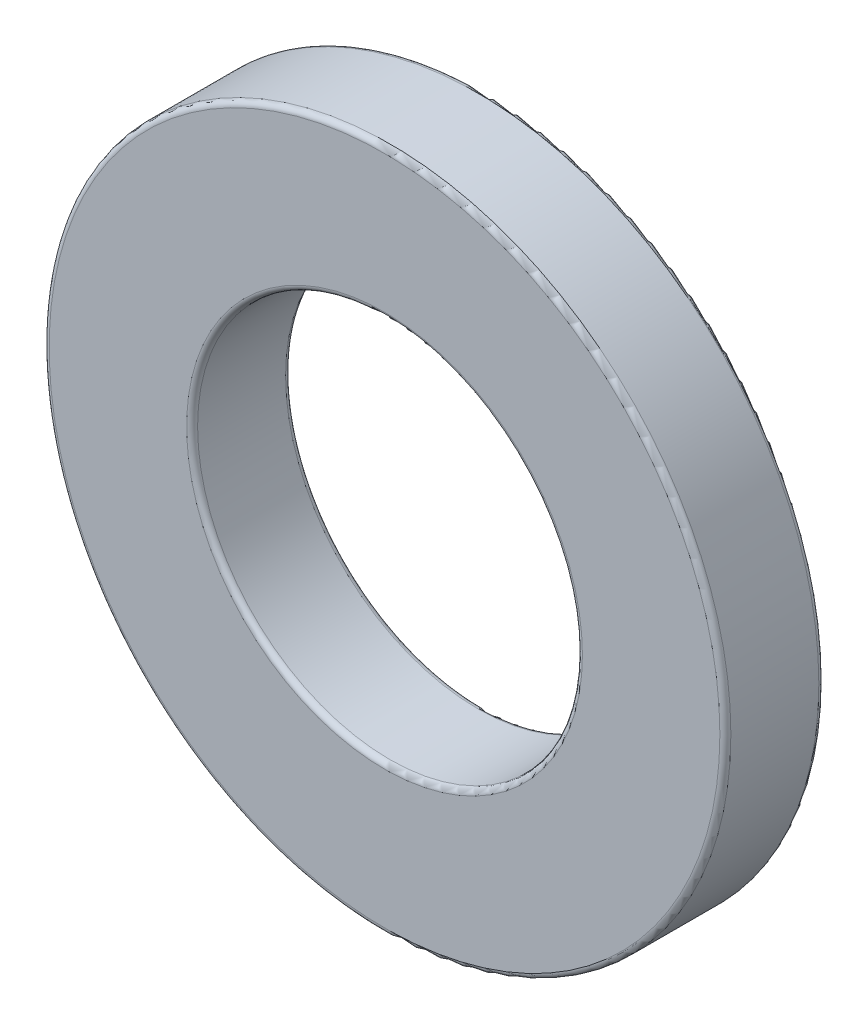
from build123d import *

# Parameters (mm, degrees)
SKETCH_1_R      = 31
SKETCH_1_R_2    = 17.5
EXTRUDE_1_DEPTH = 9
FILLET_1_R      = 0.5


with BuildPart() as part:
    # 草图1 → 拉伸1 (new body)
    with BuildSketch(Plane.XY):
        Circle(SKETCH_1_R)
        Circle(SKETCH_1_R_2, mode=Mode.SUBTRACT)
    extrude(amount=EXTRUDE_1_DEPTH)

    # 圆角1
    fillet_1_edges = [part.edges().sort_by_distance(p)[0] for p in [
        (-31, 0, 0),
        (-31, 0, 9),
        (-17.5, 0, 0),
        (-17.5, 0, 9),
    ]]
    fillet(fillet_1_edges, radius=FILLET_1_R)


solid = part.part
